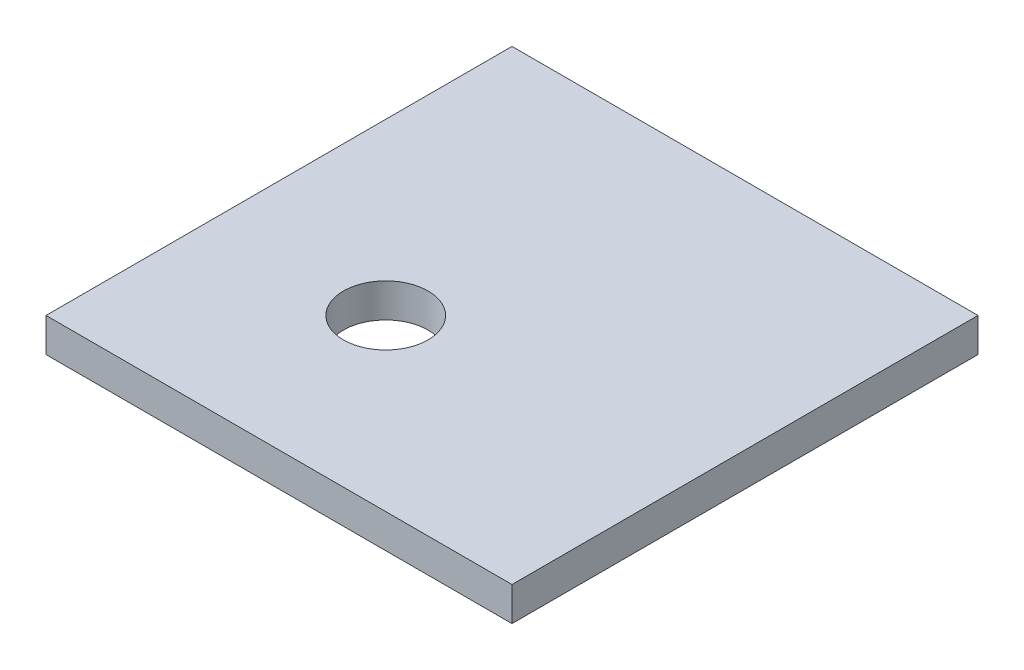
from build123d import *

# Parameters (mm, degrees)
SKETCH_1_W          = 110
SKETCH_1_H          = 110
EXTRUDE_1_DEPTH     = 8
SKETCH_6_R          = 10
CUT_EXTRUDE_1_DEPTH = 8


with BuildPart() as part:
    # 草图1 → 凸台-拉伸1 (new body)
    with BuildSketch(Plane(origin=(0, 0, 0), x_dir=(1, 0, 0), z_dir=(0, 1, 0))):
        with Locations((5.515759312, -19.856733524)):
            Rectangle(SKETCH_1_W, SKETCH_1_H)
    extrude(amount=EXTRUDE_1_DEPTH)

    # 草图6 → 切除-拉伸1 (cut)
    with BuildSketch(Plane(origin=(0, 8, 0), x_dir=(1, 0, 0), z_dir=(0, 1, 0))):
        with Locations(Location((-9.386622595, -34.759115431, 0), (0, 0, 270))):
            Circle(SKETCH_6_R)
    extrude(amount=-CUT_EXTRUDE_1_DEPTH, mode=Mode.SUBTRACT)


solid = part.part
